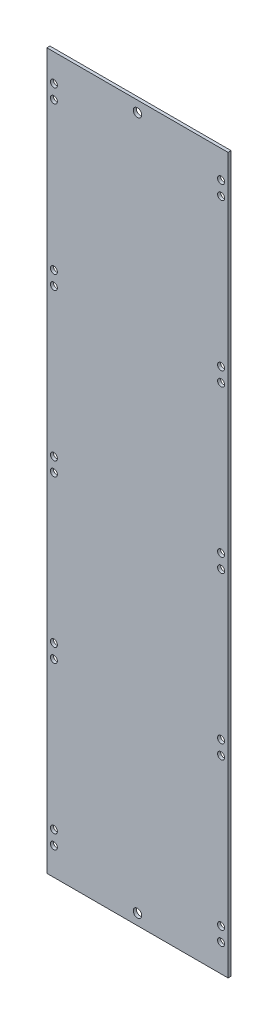
from build123d import *

# Parameters (mm, degrees)
SKETCH1_W           = 83
SKETCH1_H           = 327.5
BOSS_EXTRUDE1_DEPTH = 1.397
SKETCH2_R           = 1.6
CUT_EXTRUDE1_DEPTH  = 1.397
SKETCH3_R           = 1.93
CUT_EXTRUDE2_DEPTH  = 1.397


with BuildPart() as part:
    # Sketch1 → Boss-Extrude1 (new body)
    with BuildSketch(Plane.XY):
        with Locations((41.5, 163.75)):
            Rectangle(SKETCH1_W, SKETCH1_H)
    extrude(amount=BOSS_EXTRUDE1_DEPTH)

    # Sketch2 → Cut-Extrude1 (cut)
    with BuildSketch(Plane.XY.offset(1.397)):
        with Locations((3.2, 314.9)):
            Circle(SKETCH2_R)
        with Locations((3.2, 308.5)):
            Circle(SKETCH2_R)
        with Locations((79.8, 314.9)):
            Circle(SKETCH2_R)
        with Locations((79.8, 308.5)):
            Circle(SKETCH2_R)
        with Locations((3.2, 240.925)):
            Circle(SKETCH2_R)
        with Locations((3.2, 234.525)):
            Circle(SKETCH2_R)
        with Locations((79.8, 240.925)):
            Circle(SKETCH2_R)
        with Locations((79.8, 234.525)):
            Circle(SKETCH2_R)
        with Locations((3.2, 166.95)):
            Circle(SKETCH2_R)
        with Locations((3.2, 160.55)):
            Circle(SKETCH2_R)
        with Locations((79.8, 166.95)):
            Circle(SKETCH2_R)
        with Locations((79.8, 160.55)):
            Circle(SKETCH2_R)
        with Locations((3.2, 92.975)):
            Circle(SKETCH2_R)
        with Locations((3.2, 86.575)):
            Circle(SKETCH2_R)
        with Locations((79.8, 92.975)):
            Circle(SKETCH2_R)
        with Locations((79.8, 86.575)):
            Circle(SKETCH2_R)
        with Locations((3.2, 19)):
            Circle(SKETCH2_R)
        with Locations((3.2, 12.6)):
            Circle(SKETCH2_R)
        with Locations((79.8, 19)):
            Circle(SKETCH2_R)
        with Locations((79.8, 12.6)):
            Circle(SKETCH2_R)
    extrude(amount=-CUT_EXTRUDE1_DEPTH, mode=Mode.SUBTRACT)

    # Sketch3 → Cut-Extrude2 (cut)
    with BuildSketch(Plane.XY.offset(1.397)):
        with Locations((41.5, 322.524)):
            Circle(SKETCH3_R)
        with Locations((41.5, 4.976)):
            Circle(SKETCH3_R)
    extrude(amount=-CUT_EXTRUDE2_DEPTH, mode=Mode.SUBTRACT)


solid = part.part
